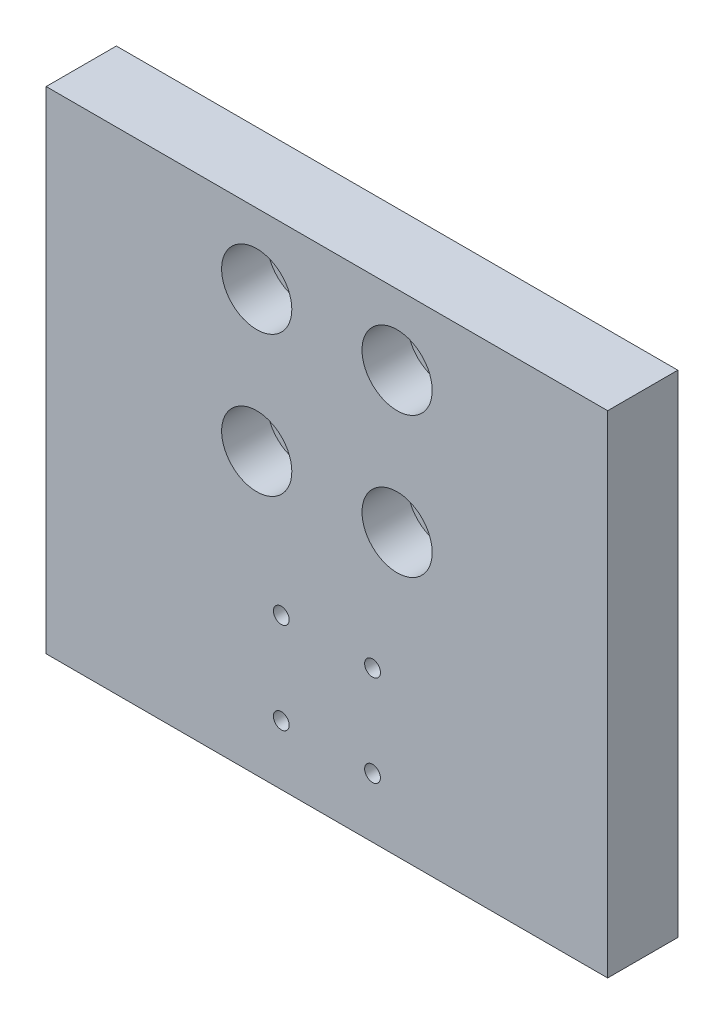
from build123d import *

# Parameters (mm, degrees)
SKETCH1_W               = 160
SKETCH1_H               = 140
BOSS_EXTRUDE1_DEPTH     = 20
CUT_EXTRUDE1_DEPTH      = 189.944436277
CUT_EXTRUDE1_DEPTH_BACK = 189.944436277
SKETCH2_R               = 6.75
SKETCH3_R               = 10
CUT_EXTRUDE3_DEPTH      = 13
CUT_EXTRUDE4_DEPTH      = 189.944436277
CUT_EXTRUDE4_DEPTH_BACK = 189.944436277
SKETCH4_R               = 2.25
SKETCH5_R               = 4
CUT_EXTRUDE6_DEPTH      = 4.5


with BuildPart() as part:
    # Sketch1 → Boss-Extrude1 (new body)
    with BuildSketch(Plane.XY):
        with Locations((0, -100)):
            Rectangle(SKETCH1_W, SKETCH1_H)
    extrude(amount=BOSS_EXTRUDE1_DEPTH)

    # Sketch2 → Cut-Extrude1 (cut, two sides: drawn at the far end of the back side and taken through both)
    with BuildSketch(Plane.XY.offset(-CUT_EXTRUDE1_DEPTH_BACK)):
        with Locations((-20, -50)):
            Circle(SKETCH2_R)
        with Locations((-20, -90)):
            Circle(SKETCH2_R)
        with Locations((20, -50)):
            Circle(SKETCH2_R)
        with Locations((20, -90)):
            Circle(SKETCH2_R)
    extrude(amount=CUT_EXTRUDE1_DEPTH + CUT_EXTRUDE1_DEPTH_BACK, mode=Mode.SUBTRACT)

    # Sketch3 → Cut-Extrude3 (cut)
    with BuildSketch(Plane.XY.offset(20)):
        with Locations((-20, -50)):
            Circle(SKETCH3_R)
        with Locations((-20, -90)):
            Circle(SKETCH3_R)
        with Locations((20, -50)):
            Circle(SKETCH3_R)
        with Locations((20, -90)):
            Circle(SKETCH3_R)
    extrude(amount=-CUT_EXTRUDE3_DEPTH, mode=Mode.SUBTRACT)

    # Sketch4 → Cut-Extrude4 (cut, two sides: drawn at the far end of the back side and taken through both)
    with BuildSketch(Plane.XY.offset(-CUT_EXTRUDE4_DEPTH_BACK)):
        with Locations((-13, -127)):
            Circle(SKETCH4_R)
        with Locations((-13, -153)):
            Circle(SKETCH4_R)
        with Locations((13, -127)):
            Circle(SKETCH4_R)
        with Locations((13, -153)):
            Circle(SKETCH4_R)
    extrude(amount=CUT_EXTRUDE4_DEPTH + CUT_EXTRUDE4_DEPTH_BACK, mode=Mode.SUBTRACT)

    # Sketch5 → Cut-Extrude6 (cut)
    with BuildSketch(Plane.XY):
        with Locations((-13, -127)):
            Circle(SKETCH5_R)
        with Locations((-13, -153)):
            Circle(SKETCH5_R)
        with Locations((13, -127)):
            Circle(SKETCH5_R)
        with Locations((13, -153)):
            Circle(SKETCH5_R)
    extrude(amount=CUT_EXTRUDE6_DEPTH, mode=Mode.SUBTRACT)


solid = part.part
